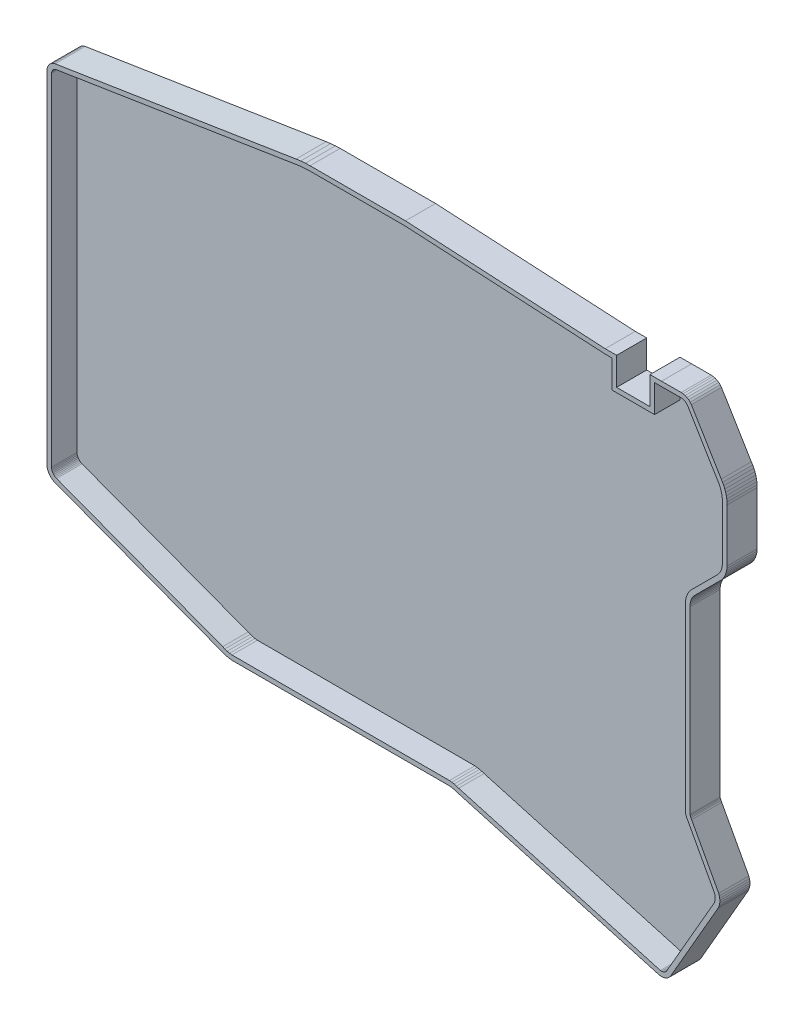
from build123d import *

# Parameters (mm, degrees)
BOSS_EXTRU_1_DEPTH = 6.5
COQUE1_T           = -1


with BuildPart() as part:
    # Esquisse1 → Boss.-Extru.1 (new body)
    with BuildSketch(Plane.XY):
        Polygon((121.817464, 7.492943), (119.344698096, 7.492943), (76.183818096, 9.845583), (55.564779836, 9.845583), (54.552173404, 9.812435234), (53.533209696, 9.726302114), (52.535480793, 9.589824274), (0.457881428, 1.377587451), (0.080923827, 1.263928085), (-0.29188868, 1.068065272), (-0.62076937, 0.805019767), (-0.893764513, 0.484354906), (-1.100960827, 0.11771658), (-1.234846295, -0.281630821), (-1.286572721, -0.669801542), (-1.313614475, -74.551979081), (-1.278040024, -74.923678753), (-1.183440664, -75.310181205), (-1.034124026, -75.679013791), (-0.83321163, -76.022476002), (-0.584894436, -76.333396945), (-0.29436239, -76.605283146), (0.032415912, -76.832524633), (0.369780396, -77.00084256), (36.304970835, -90.526464897), (36.80277452, -90.74345953), (37.387467468, -90.935559968), (37.987559572, -91.072151235), (38.615965116, -91.154417), (85.623172099, -91.154417), (86.041723807, -91.203108273), (86.479101326, -91.284778635), (86.909816867, -91.396315659), (87.386772904, -91.555543407), (131.068933438, -103.89053292), (131.455504757, -103.929660689), (131.837402239, -103.90606587), (132.210442209, -103.820965251), (132.564787964, -103.676607455), (132.89109687, -103.476794608), (133.180788715, -103.226774051), (133.429739598, -102.92886536), (143.750781449, -85.005495121), (143.915060156, -84.629514823), (144.034345378, -84.231627617), (144.104871469, -83.822278759), (144.125612773, -83.407413185), (144.096265486, -82.993066766), (144.017262186, -82.585292428), (143.880179871, -82.160245981), (138.026657959, -71.311045886), (137.876543424, -71.058845944), (137.78546804, -70.860016908), (137.716227615, -70.652585277), (137.681143, -70.491756357), (137.681143, -31.622548821), (137.6990854, -31.232462255), (137.749599164, -30.868463071), (137.833314637, -30.510636851), (137.949524742, -30.162007333), (138.097248212, -29.82551681), (138.275237168, -29.504008987), (138.454865034, -29.240054529), (144.543883236, -23.151036326), (144.845002348, -22.736623208), (145.089736472, -22.322824981), (145.294432727, -21.887826778), (145.457273896, -21.435491716), (145.576812433, -20.969836233), (145.651988542, -20.494996542), (145.681143, -20.030945018), (145.681143, -8.589075407), (145.669842672, -8.050387206), (145.61465745, -7.486457006), (145.516495569, -6.928400528), (145.37593068, -6.379489779), (145.193788673, -5.842940054), (144.971135156, -5.321894978), (144.70927891, -4.819414981), (144.433744876, -4.376954091), (137.970333494, 6.337024694), (137.701988909, 6.669821714), (137.372955521, 6.963781332), (137.000567914, 7.200433726), (136.594704241, 7.373498612), (136.166125996, 7.47838751), (135.767380568, 7.509136644), (131.515559688, 7.492943), (129.017464, 7.492943), (129.017464, 1.492943), (121.817464, 1.492943), align=None)
    extrude(amount=-BOSS_EXTRU_1_DEPTH)

    # Coque1
    coque1_openings = [part.faces().sort_by_distance(p)[0] for p in [
        (72.557857735, -42.2287033, 0),
    ]]
    offset(amount=COQUE1_T, openings=coque1_openings, kind=Kind.INTERSECTION)


solid = part.part
